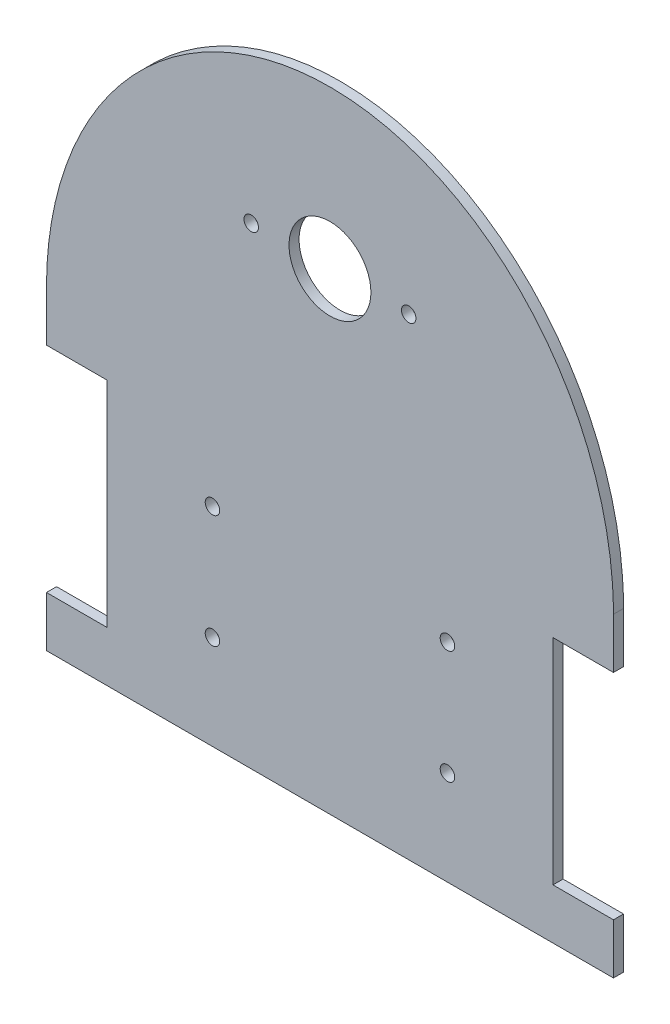
from build123d import *

# Parameters (mm, degrees)
SKETCH1_W           = 90
SKETCH1_H           = 100
BOSS_EXTRUDE1_DEPTH = 1.6
CUT_EXTRUDE1_DEPTH  = 68.287145875
SKETCH3_W           = 9.6
SKETCH3_H           = 34
CUT_EXTRUDE2_DEPTH  = 68.287146019
SKETCH4_R           = 6.5
CUT_EXTRUDE3_DEPTH  = 68.287146019
SKETCH5_R           = 1.15
CUT_EXTRUDE4_DEPTH  = 68.287146019
SKETCH6_R           = 1.15
CUT_EXTRUDE5_DEPTH  = 68.287146019


with BuildPart() as part:
    # Sketch1 → Boss-Extrude1 (new body)
    with BuildSketch(Plane.XY):
        Rectangle(SKETCH1_W, SKETCH1_H)
    extrude(amount=BOSS_EXTRUDE1_DEPTH)

    # Sketch2 → Cut-Extrude1 (cut, through all)
    with BuildSketch(Plane.XY.offset(1.6)):
        with BuildLine():
            Line((-45, 0), (-70, 0))
            Line((-70, 0), (-70, 70))
            Line((-70, 70), (70, 70))
            Line((70, 70), (70, 0))
            Line((70, 0), (45, 0))
            add(Edge.make_bspline(
                [(45, 0), (45, 50), (0, 50), (-45, 50), (-45, 0)],
                knots=[1.570796327, 1.570796327, 1.570796327, 3.141592654, 3.141592654, 4.71238898, 4.71238898, 4.71238898], degree=2, weights=[1, 0.707106781, 1, 0.707106781, 1]))
        make_face()
    extrude(amount=-CUT_EXTRUDE1_DEPTH, mode=Mode.SUBTRACT)

    # Sketch3 → Cut-Extrude2 (cut, through all)
    with BuildSketch(Plane.XY.offset(1.6)):
        with Locations((-40.2, -25)):
            Rectangle(SKETCH3_W, SKETCH3_H)
        with Locations((40.2, -25)):
            Rectangle(SKETCH3_W, SKETCH3_H)
    extrude(amount=-CUT_EXTRUDE2_DEPTH, mode=Mode.SUBTRACT)

    # Sketch4 → Cut-Extrude3 (cut, through all)
    with BuildSketch(Plane.XY.offset(1.6)):
        with Locations((0, 25)):
            Circle(SKETCH4_R)
    extrude(amount=-CUT_EXTRUDE3_DEPTH, mode=Mode.SUBTRACT)

    # Sketch5 → Cut-Extrude4 (cut, through all)
    with BuildSketch(Plane.XY.offset(1.6)):
        with Locations((-18.65, -17)):
            Circle(SKETCH5_R)
        with Locations((-18.65, -35)):
            Circle(SKETCH5_R)
        with Locations(Location((18.65, -35, 0), (0, 0, 180))):
            Circle(SKETCH5_R)
        with Locations(Location((18.65, -17, 0), (0, 0, 180))):
            Circle(SKETCH5_R)
    extrude(amount=-CUT_EXTRUDE4_DEPTH, mode=Mode.SUBTRACT)

    # Sketch6 → Cut-Extrude5 (cut, through all)
    with BuildSketch(Plane.XY.offset(1.6)):
        with Locations((-12.5, 25)):
            Circle(SKETCH6_R)
        with Locations((12.5, 25)):
            Circle(SKETCH6_R)
    extrude(amount=-CUT_EXTRUDE5_DEPTH, mode=Mode.SUBTRACT)


solid = part.part
